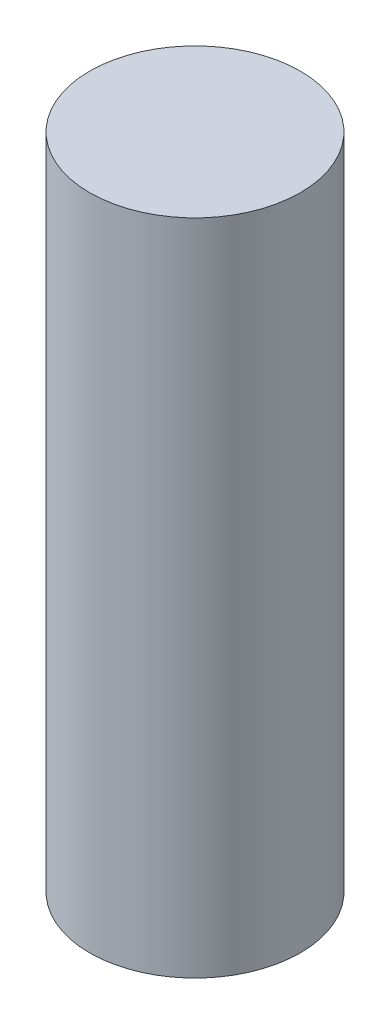
from build123d import *

# Parameters (mm, degrees)
SKETCH1_R           = 4
BOSS_EXTRUDE1_DEPTH = 25


with BuildPart() as part:
    # Sketch1 → Boss-Extrude1 (new body)
    with BuildSketch(Plane(origin=(0, 0, 0), x_dir=(1, 0, 0), z_dir=(0, 1, 0))):
        with Locations(Location((0, 0, 0), (0, 0, 270))):
            Circle(SKETCH1_R)
    extrude(amount=BOSS_EXTRUDE1_DEPTH)


solid = part.part
